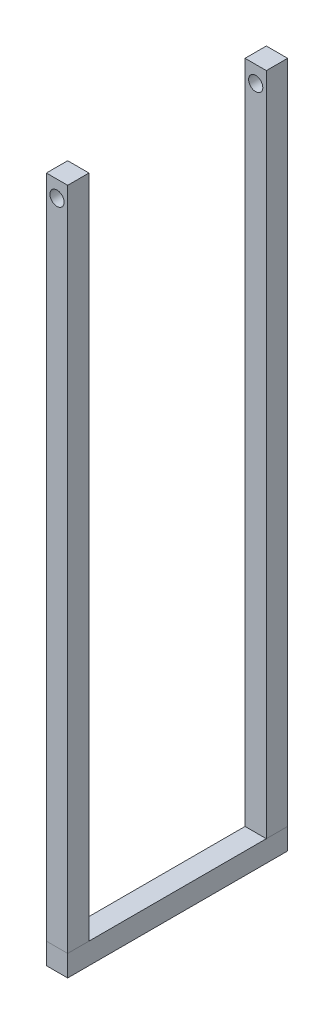
from build123d import *

# Parameters (mm, degrees)
SKETCH1_W               = 12
SKETCH1_H               = 12
BOSS_EXTRUDE1_DEPTH     = 375
SKETCH3_W               = 12
SKETCH3_H               = 12
BOSS_EXTRUDE2_DEPTH     = 124
SKETCH4_W               = 12
SKETCH4_H               = 12
BOSS_EXTRUDE3_DEPTH     = 375
CUT_EXTRUDE2_DEPTH      = 392.414102965
CUT_EXTRUDE2_DEPTH_BACK = 392.414102965
SKETCH2_R               = 4


with BuildPart() as part:
    # Sketch1 → Boss-Extrude1 (new body)
    with BuildSketch(Plane(origin=(0, 0, 0), x_dir=(1, 0, 0), z_dir=(0, 1, 0))):
        Rectangle(SKETCH1_W, SKETCH1_H)
    extrude(amount=BOSS_EXTRUDE1_DEPTH)


with BuildPart() as body_2:
    # Sketch3 → Boss-Extrude2 (new body)
    with BuildSketch(Plane(origin=(0, 0, -6), x_dir=(-1, 0, 0), z_dir=(0, 0, -1))):
        with Locations((0, -6)):
            Rectangle(SKETCH3_W, SKETCH3_H)
    extrude(amount=-BOSS_EXTRUDE2_DEPTH)


with BuildPart() as body_3:
    # Sketch4 → Boss-Extrude3 (new body)
    with BuildSketch(Plane(origin=(0, 0, 0), x_dir=(1, 0, 0), z_dir=(0, 1, 0))):
        with Locations((0, -112)):
            Rectangle(SKETCH4_W, SKETCH4_H)
    extrude(amount=BOSS_EXTRUDE3_DEPTH)


with BuildPart() as cut_extrude2_tool:
    # Sketch2 → Cut-Extrude2 (new, two sides: drawn at the far end of the back side and taken through both)
    with BuildSketch(Plane.XY.offset(6).offset(-CUT_EXTRUDE2_DEPTH_BACK)):
        with Locations((0, 365.684639754)):
            Circle(SKETCH2_R)
    extrude(amount=CUT_EXTRUDE2_DEPTH + CUT_EXTRUDE2_DEPTH_BACK)


with BuildPart() as part_1:
    add(part.part)

    # Cut-Extrude2: cut by cut_extrude2_tool
    add(cut_extrude2_tool.part, mode=Mode.SUBTRACT)


with BuildPart() as body_3_1:
    add(body_3.part)

    # Cut-Extrude2: cut by cut_extrude2_tool
    add(cut_extrude2_tool.part, mode=Mode.SUBTRACT)


solid = Compound([body_2.part, part_1.part, body_3_1.part])
